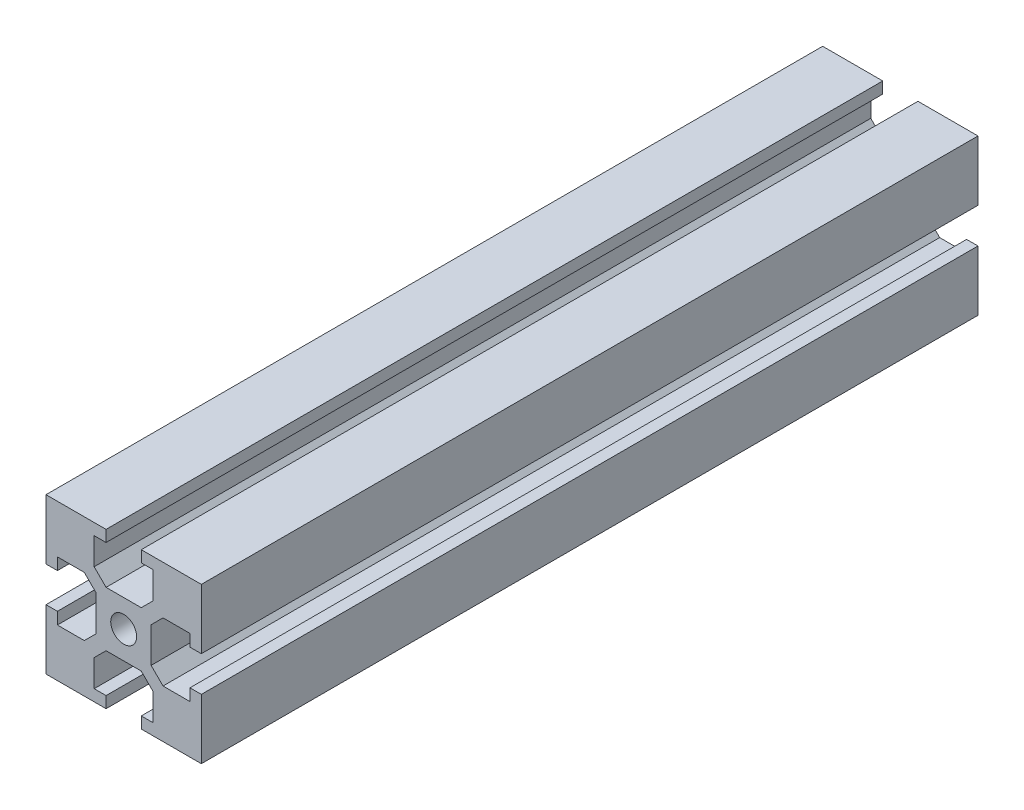
from build123d import *

# Parameters (mm, degrees)
SKETCH_2_R      = 1.25
EXTRUDE_1_DEPTH = 75


with BuildPart() as part:
    # ｽｹｯﾁ2 → ﾎﾞｽ - 押し出し1 (new body)
    with BuildSketch(Plane.XY):
        Polygon((1.7, 2.65), (-1.7, 2.65), (-2.85, 3.8), (-2.85, 6.4), (-1.7, 6.4), (-1.7, 7.5), (-7.5, 7.5), (-7.5, 1.7), (-6.4, 1.7), (-6.4, 2.85), (-3.8, 2.85), (-2.65, 1.7), (-2.65, -1.7), (-3.8, -2.85), (-6.4, -2.85), (-6.4, -1.7), (-7.5, -1.7), (-7.5, -7.5), (-1.7, -7.5), (-1.7, -6.4), (-2.85, -6.4), (-2.85, -3.8), (-1.7, -2.65), (1.7, -2.65), (2.85, -3.8), (2.85, -6.4), (1.7, -6.4), (1.7, -7.5), (7.5, -7.5), (7.5, -1.7), (6.4, -1.7), (6.4, -2.85), (3.8, -2.85), (2.65, -1.7), (2.65, 1.7), (3.8, 2.85), (6.4, 2.85), (6.4, 1.7), (7.5, 1.7), (7.5, 7.5), (1.7, 7.5), (1.7, 6.4), (2.85, 6.4), (2.85, 3.8), align=None)
        Circle(SKETCH_2_R, mode=Mode.SUBTRACT)
    extrude(amount=EXTRUDE_1_DEPTH)


solid = part.part
